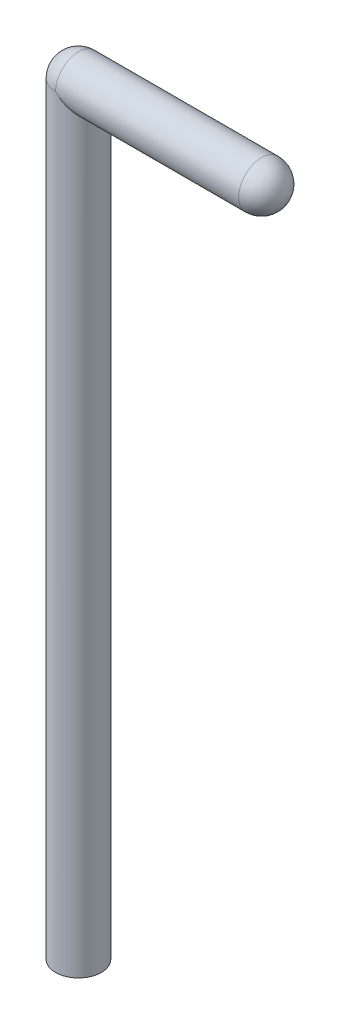
from build123d import *

# Parameters (mm, degrees)
SKETCH_1_R      = 0.75
EXTRUDE_1_DEPTH = 25
SKETCH_3_R      = 0.75
EXTRUDE_2_DEPTH = 6


with BuildPart() as part:
    # 草图1 → 凸台-拉伸1 (new body)
    with BuildSketch(Plane(origin=(0, 0, 0), x_dir=(1, 0, 0), z_dir=(0, 1, 0))):
        with Locations(Location((0, 0, 0), (0, 0, 270))):
            Circle(SKETCH_1_R)
    extrude(amount=EXTRUDE_1_DEPTH)

    # 草图2 → 旋转1 (revolve)
    with BuildSketch(Plane.XY):
        with BuildLine():
            Line((0, 25.75), (0, 24.25))
            ThreePointArc((0, 24.25), (0.75, 25), (0, 25.75))
        make_face()
    revolve(axis=Axis((0, 25.75, 0), (0, -1, 0)))

    # 草图3 → 凸台-拉伸2 (add)
    with BuildSketch(Plane(origin=(0, 0, 0), x_dir=(0, 0, -1), z_dir=(1, 0, 0))):
        with Locations((0, 25)):
            Circle(SKETCH_3_R)
    extrude(amount=EXTRUDE_2_DEPTH)

    # 草图4 → 旋转2 (revolve)
    with BuildSketch(Plane(origin=(6, 0, 0), x_dir=(0, 0, -1), z_dir=(1, 0, 0))):
        with BuildLine():
            Line((0, 25.75), (0, 24.25))
            ThreePointArc((0, 24.25), (0.75, 25), (0, 25.75))
        make_face()
    revolve(axis=Axis((6, 25.75, 0), (0, -1, 0)))


solid = part.part
